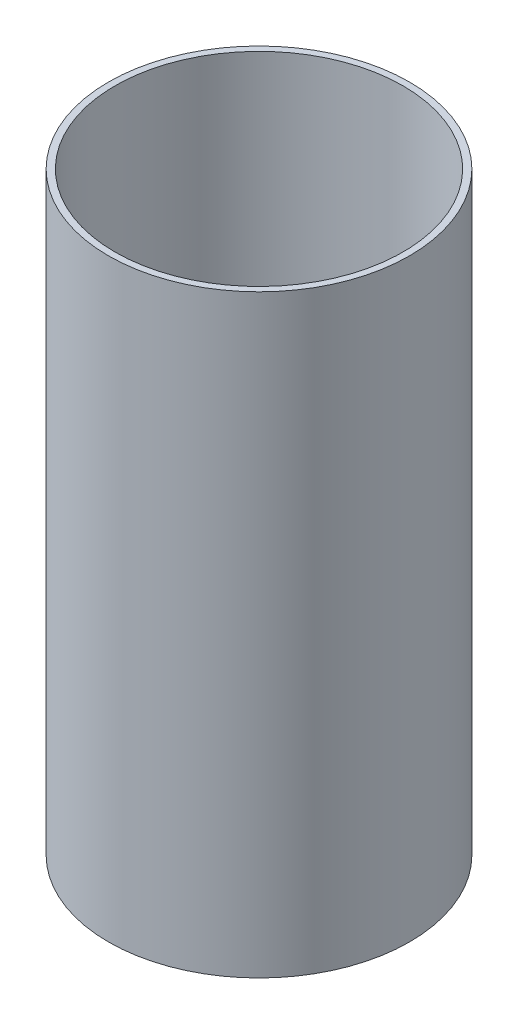
from build123d import *

# Parameters (mm, degrees)
ESQUISSE1_R        = 76
ESQUISSE1_R_2      = 72.7
BOSS_EXTRU_1_DEPTH = 300


with BuildPart() as part:
    # Esquisse1 → Boss.-Extru.1 (new body)
    with BuildSketch(Plane(origin=(0, 0, 0), x_dir=(1, 0, 0), z_dir=(0, 1, 0))):
        with Locations(Location((0, 0, 0), (0, 0, 270))):
            Circle(ESQUISSE1_R)
        with Locations(Location((0, 0, 0), (0, 0, 270))):
            Circle(ESQUISSE1_R_2, mode=Mode.SUBTRACT)
    extrude(amount=BOSS_EXTRU_1_DEPTH)


solid = part.part
